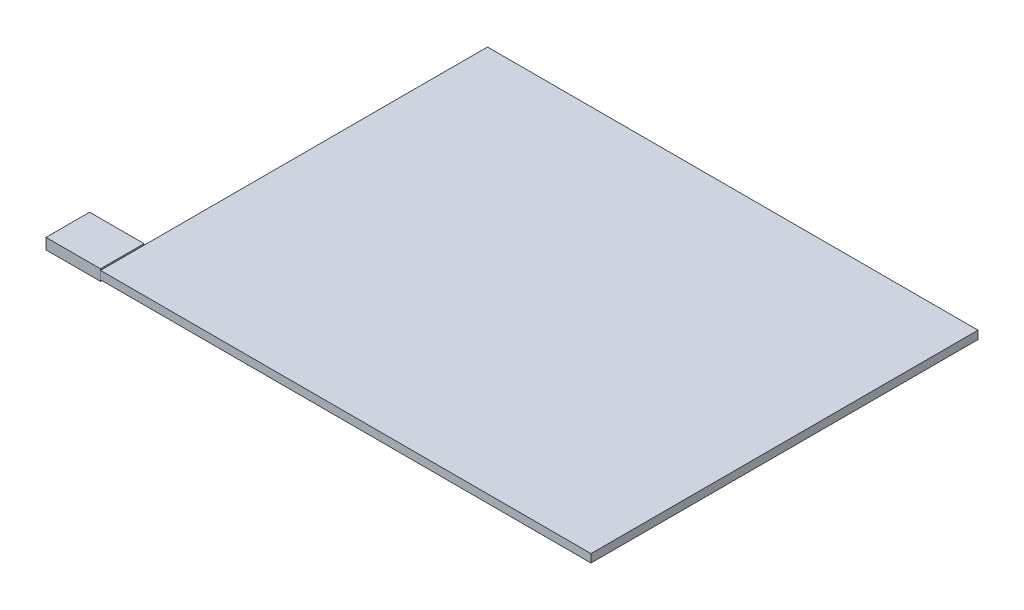
from build123d import *

# Parameters (mm, degrees)
SKETCH1_W           = 148
SKETCH1_H           = 105
BOSS_EXTRUDE1_DEPTH = 0.75
SKETCH2_W           = 10
SKETCH2_H           = 8
BOSS_EXTRUDE2_DEPTH = 1
CUT_EXTRUDE1_DEPTH  = 1.5


with BuildPart() as part:
    # Sketch1 → Boss-Extrude1 (new, symmetric)
    with BuildSketch(Plane(origin=(0, 0, 0), x_dir=(1, 0, 0), z_dir=(0, 1, 0))):
        Rectangle(SKETCH1_W, SKETCH1_H)
    extrude(amount=BOSS_EXTRUDE1_DEPTH, both=True)

    # Sketch3 → Cut-Extrude1 (cut)
    with BuildSketch(Plane(origin=(0, 0.75, 0), x_dir=(1, 0, 0), z_dir=(0, 1, 0))):
        Polygon((16, 18.5), (16, -52.5), (74, -52.5), (74, 52.5), (-74, 52.5), (-74, 18.5), align=None)
    extrude(amount=-CUT_EXTRUDE1_DEPTH, mode=Mode.SUBTRACT)


with BuildPart() as body_2:
    # Sketch2 → Boss-Extrude2 (new, symmetric)
    with BuildSketch(Plane(origin=(0, 0, 0), x_dir=(1, 0, 0), z_dir=(0, 1, 0))):
        with Locations((-79, -48.5)):
            Rectangle(SKETCH2_W, SKETCH2_H)
    extrude(amount=BOSS_EXTRUDE2_DEPTH, both=True)


solid = Compound([part.part, body_2.part])
